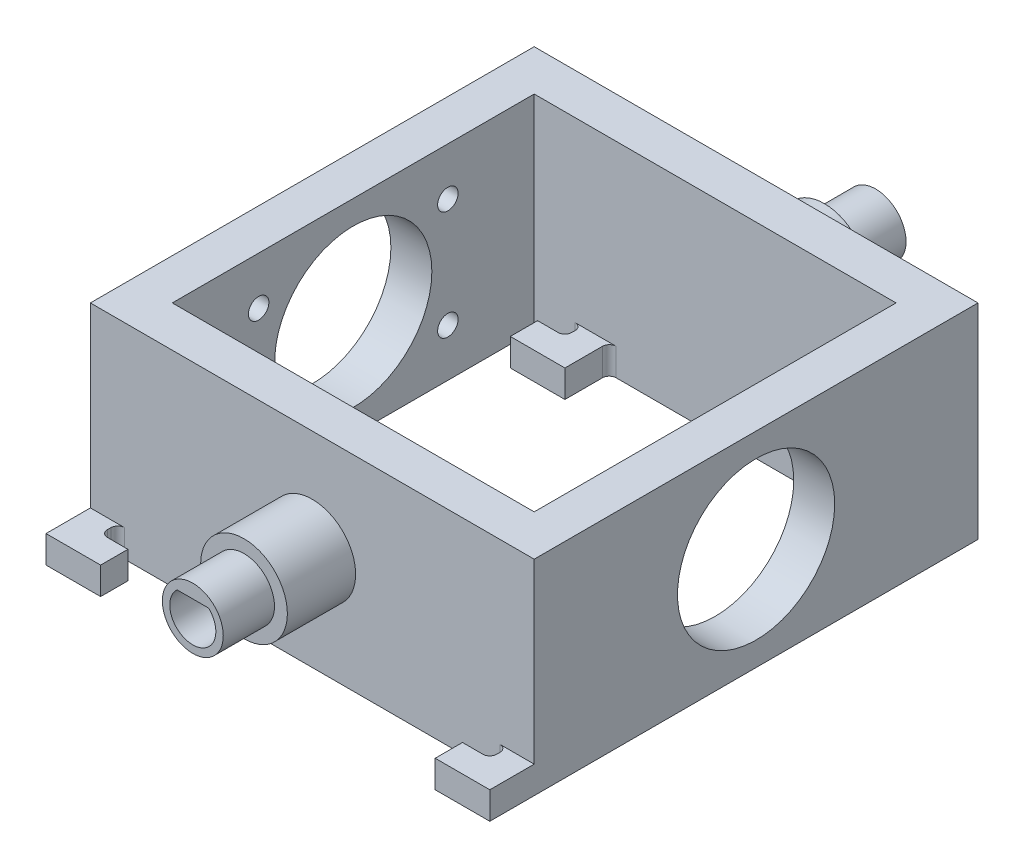
from build123d import *

# Parameters (mm, degrees)
SKETCH1_W           = 65
SKETCH1_H           = 65
SKETCH1_W_2         = 53
SKETCH1_H_2         = 53
BOSS_EXTRUDE1_DEPTH = 30
SKETCH3_R           = 11.5125
CUT_EXTRUDE2_DEPTH  = 97.695398029
SKETCH2_R           = 4.4625
BOSS_EXTRUDE2_DEPTH = 17.5
BOSS_EXTRUDE3_START = -82.5
SKETCH2_2_R         = 4.4625
BOSS_EXTRUDE3_DEPTH = 17.5
CUT_EXTRUDE3_REACH  = 124.984
SKETCH5_R           = 6.35
SKETCH5_R_2         = 4.4625
BOSS_EXTRUDE4_DEPTH = 10
BOSS_EXTRUDE5_START = 10
SKETCH6_R           = 6.35
SKETCH6_R_2         = 4.4625
BOSS_EXTRUDE5_DEPTH = 10
SKETCH7_R           = 1.5
CUT_EXTRUDE4_DEPTH  = 10
BOSS_EXTRUDE6_START = 30
BOSS_EXTRUDE6_DEPTH = 4
BOSS_EXTRUDE8_DEPTH = 4
FILLET3_R           = 1


with BuildPart() as part:
    # Sketch1 → Boss-Extrude1 (new body)
    with BuildSketch(Plane(origin=(0, 0, 0), x_dir=(1, 0, 0), z_dir=(0, 1, 0))):
        with Locations((32.5, 32.5)):
            Rectangle(SKETCH1_W, SKETCH1_H)
        with Locations((32.5, 32.5)):
            Rectangle(SKETCH1_W_2, SKETCH1_H_2, mode=Mode.SUBTRACT)
    extrude(amount=BOSS_EXTRUDE1_DEPTH)

    # Sketch3 → Cut-Extrude2 (cut, through all)
    with BuildSketch(Plane(origin=(65, 0, 0), x_dir=(0, 0, -1), z_dir=(1, 0, 0))):
        with Locations((32.5, 15)):
            Circle(SKETCH3_R)
    extrude(amount=-CUT_EXTRUDE2_DEPTH, mode=Mode.SUBTRACT)

    # Sketch2 → Boss-Extrude2 (add)
    with BuildSketch(Plane.XY):
        with Locations(Location((32.5, 15, 0), (0, 0, 180))):
            Circle(SKETCH2_R)
    extrude(amount=BOSS_EXTRUDE2_DEPTH)

    # Sketch2<2> → Boss-Extrude3 (add)
    with BuildSketch(Plane.XY.offset(BOSS_EXTRUDE3_START)):
        with Locations(Location((32.5, 15, 0), (0, 0, 180))):
            Circle(SKETCH2_2_R)
    extrude(amount=BOSS_EXTRUDE3_DEPTH)

    # Sketch4 → Cut-Extrude3 (cut, up to next)
    with BuildSketch(Plane.XY.offset(17.5), mode=Mode.PRIVATE) as cut_extrude3_sk1:
        with BuildLine():
            Line((30.185, 17.455890877), (34.815, 17.455890877))
            ThreePointArc((34.815, 17.455890877), (32.5, 11.625), (30.185, 17.455890877))
        make_face()
    cut_extrude3_tool1 = extrude(cut_extrude3_sk1.sketch, amount=-CUT_EXTRUDE3_REACH, mode=Mode.PRIVATE) & part.part
    add(cut_extrude3_tool1.solids().sort_by_distance((32.5, 14.748295, 17.5))[0], mode=Mode.SUBTRACT)

    # Sketch5 → Boss-Extrude4 (add)
    with BuildSketch(Plane.XY):
        with Locations(Location((32.5, 15, 0), (0, 0, 180))):
            Circle(SKETCH5_R)
        with Locations((32.5, 15)):
            Circle(SKETCH5_R_2, mode=Mode.SUBTRACT)
    extrude(amount=BOSS_EXTRUDE4_DEPTH)

    # Sketch6 → Boss-Extrude5 (add)
    with BuildSketch(Plane(origin=(0, 0, -65), x_dir=(-1, 0, 0), z_dir=(0, 0, -1)).offset(BOSS_EXTRUDE5_START)):
        with Locations((-32.5, 15)):
            Circle(SKETCH6_R)
        with Locations(Location((-32.5, 15, 0), (0, 0, 180))):
            Circle(SKETCH6_R_2, mode=Mode.SUBTRACT)
    extrude(amount=-BOSS_EXTRUDE5_DEPTH)

    # Sketch7 → Cut-Extrude4 (cut)
    with BuildSketch(Plane.ZY):
        with Locations((-46.356406461, 23)):
            Circle(SKETCH7_R)
        with Locations(Location((-46.356406461, 7, 0), (0, 0, 180))):
            Circle(SKETCH7_R)
        with Locations(Location((-18.643593539, 23, 0), (0, 0, 180))):
            Circle(SKETCH7_R)
        with Locations((-18.643593539, 7)):
            Circle(SKETCH7_R)
    extrude(amount=-CUT_EXTRUDE4_DEPTH, mode=Mode.SUBTRACT)

    # Sketch8 → Boss-Extrude6 (add)
    with BuildSketch(Plane(origin=(30, 30, 0), x_dir=(0, 0, 1), z_dir=(0, -1, 0)).offset(BOSS_EXTRUDE6_START)):
        Polygon((0, -35), (6.5, -35), (6.5, -31), (6.5, -27), (2.5, -27), (2.5, -31), (0, -31), align=None)
    boss_extrude6 = extrude(amount=-BOSS_EXTRUDE6_DEPTH)

    # Sketch9 → Boss-Extrude8 (add)
    with BuildSketch(Plane.XZ):
        Polygon((17, -59), (17, -52.5), (13, -52.5), (9, -52.5), (9, -56.5), (13, -56.5), (13, -59), align=None)
    boss_extrude8 = extrude(amount=-BOSS_EXTRUDE8_DEPTH)

    # Mirror1: Boss-Extrude6 across plane
    add(boss_extrude6.mirror(Plane.ZY.offset(-32.5)))

    # Mirror2: Boss-Extrude8 across plane
    add(boss_extrude8.mirror(Plane.XY.offset(-32.5)))

    # Fillet3
    fillet3_edges = [part.edges().sort_by_distance(p)[0] for p in [
        (61, 2, 2.5),
        (61, 2, 0),
        (17, 2, -59),
        (13, 2, -59),
        (13, 2, -56.5),
        (4, 2, 2.5),
        (4, 2, 0),
        (13, 2, -6),
        (17, 2, -6),
        (13, 2, -8.5),
    ]]
    fillet(fillet3_edges, radius=FILLET3_R)


solid = part.part
